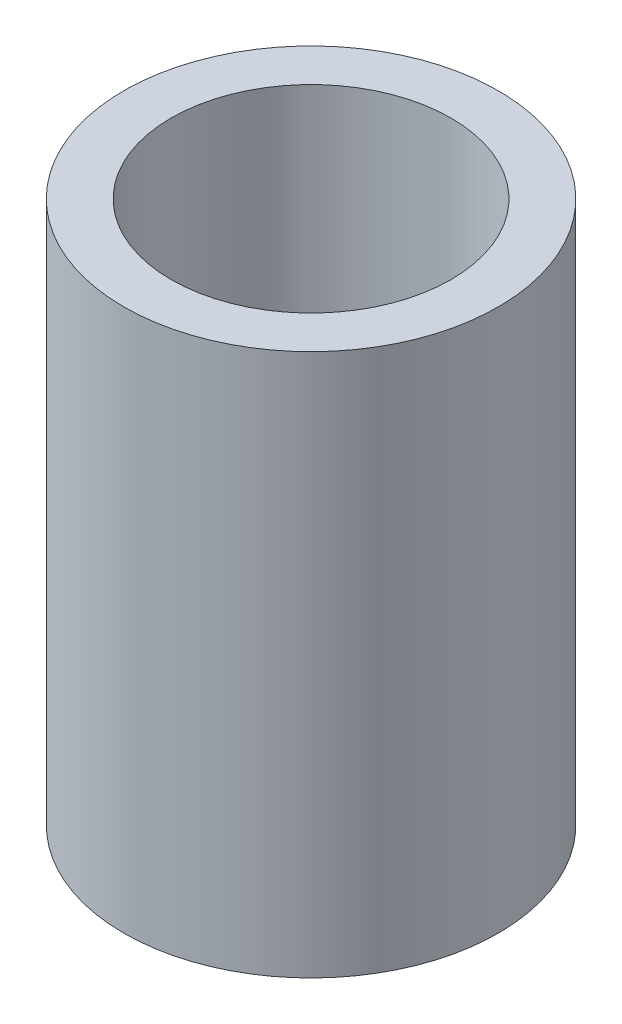
from build123d import *

# Parameters (mm, degrees)
SKETCH1_R           = 4.36626
SKETCH1_R_2         = 3.2639
BOSS_EXTRUDE1_DEPTH = 12.6492


with BuildPart() as part:
    # Sketch1 → Boss-Extrude1 (new body)
    with BuildSketch(Plane(origin=(0, 0, 0), x_dir=(1, 0, 0), z_dir=(0, 1, 0))):
        with Locations(Location((0, 0, 0), (0, 0, 270))):
            Circle(SKETCH1_R)
        with Locations(Location((0, 0, 0), (0, 0, 270))):
            Circle(SKETCH1_R_2, mode=Mode.SUBTRACT)
    extrude(amount=BOSS_EXTRUDE1_DEPTH)


solid = part.part
